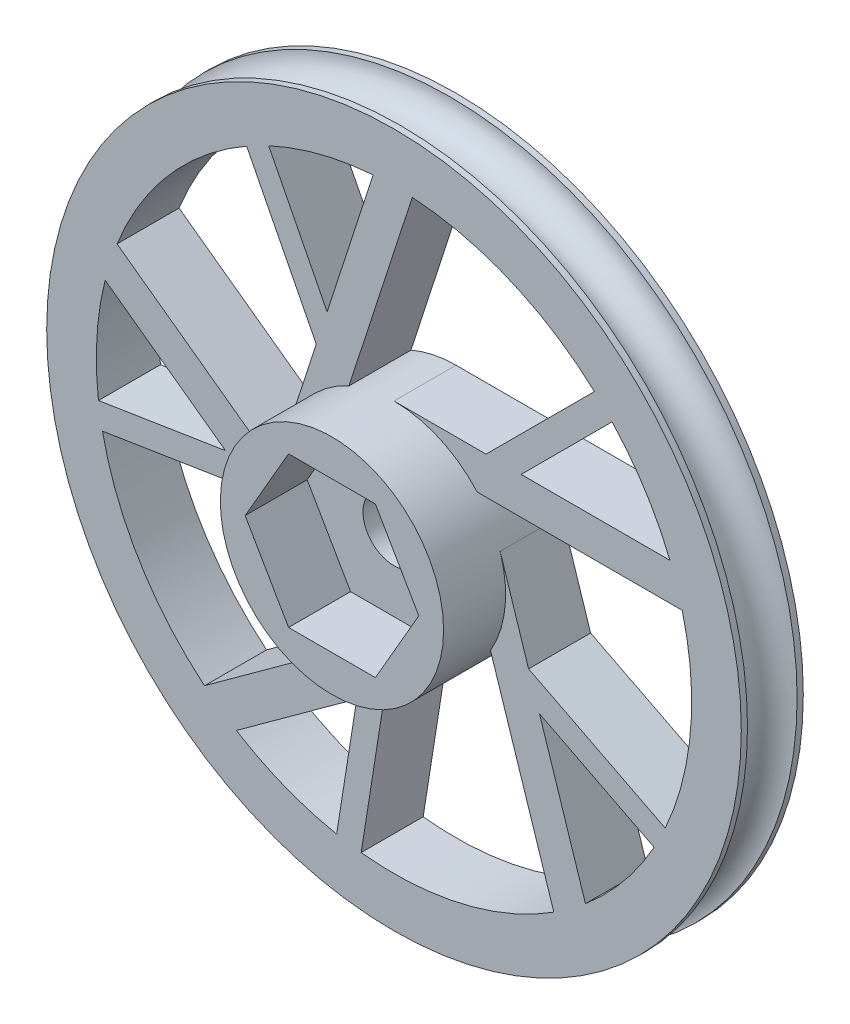
from build123d import *

# Parameters (mm, degrees)
SKETCH_1_R          = 28
SKETCH_1_R_2        = 24
EXTRUDE_1_DEPTH     = 5
SKETCH_1_3_R        = 9
EXTRUDE_2_DEPTH     = 10
SKETCH_2_R          = 2.5
CUT_EXTRUDE_1_DEPTH = 41.841155713
SKETCH_3_R          = 2


with BuildPart() as part:
    # 草图1 → 凸台-拉伸1 (new body)
    # profile 1 of 12: a face of its own
    with BuildSketch(Plane.XY):
        Circle(SKETCH_1_R)
        Circle(SKETCH_1_R_2, mode=Mode.SUBTRACT)
    # profile 2 of 12: a face of its own
    with BuildSketch(Plane.XY):
        with BuildLine():
            Line((-11.87931448, 20.853821892), (-6.26655053, 9.838152398))
            Line((-6.26655053, 9.838152398), (-5.392518481, 12.528146446))
            Line((-5.392518481, 12.528146446), (-10.101735892, 21.770506011))
            ThreePointArc((-10.101735892, 21.770506011), (-11.000078241, 21.33068866), (-11.87931448, 20.853821892))
        make_face()
    # profile 3 of 12: a face of its own
    with BuildSketch(Plane.XY):
        with BuildLine():
            ThreePointArc((-8.559508647, 2.781152949), (-6.678325674, 6.033238449), (-3.633390081, 8.233983029))
            Line((-3.633390081, 8.233983029), (1.47456694, 23.95465826))
            ThreePointArc((1.47456694, 23.95465826), (-0.105101651, 23.999769866), (-1.684314548, 23.940824641))
            Line((-1.684314548, 23.940824641), (-5.392518481, 12.528146446))
            Line((-5.392518481, 12.528146446), (-6.26655053, 9.838152398))
            Line((-6.26655053, 9.838152398), (-8.559508647, 2.781152949))
        make_face()
    # profile 4 of 12: a face of its own
    with BuildSketch(Plane.XY):
        with BuildLine():
            Line((16.162253144, 17.742084807), (7.420168337, 9))
            Line((7.420168337, 9), (10.248595461, 9))
            Line((10.248595461, 9), (17.583373541, 16.33477808))
            ThreePointArc((17.583373541, 16.33477808), (16.887479331, 17.053241388), (16.162253144, 17.742084807))
        make_face()
    # profile 5 of 12: a face of its own
    with BuildSketch(Plane.XY):
        with BuildLine():
            Line((7.420168337, 9), (0, 9))
            ThreePointArc((0, 9), (3.674234614, 8.215838363), (6.708203932, 6))
            Line((6.708203932, 6), (23.237900077, 6))
            ThreePointArc((23.237900077, 6), (22.792659325, 7.51629436), (22.248595461, 9))
            Line((22.248595461, 9), (10.248595461, 9))
            Line((10.248595461, 9), (7.420168337, 9))
        make_face()
    # profile 6 of 12: a face of its own
    with BuildSketch(Plane.XY):
        with BuildLine():
            Line((10.852466764, -4.275846499), (8.559508647, 2.781152949))
            ThreePointArc((8.559508647, 2.781152949), (8.889195065, 1.407910185), (9, 0))
            ThreePointArc((9, 0), (8.689464685, -2.34375841), (7.779288115, -4.525779096))
            Line((7.779288115, -4.525779096), (12.887245135, -20.246454327))
            ThreePointArc((12.887245135, -20.246454327), (14.191739808, -19.354444483), (15.434702745, -18.378518742))
            Line((15.434702745, -18.378518742), (11.726498813, -6.965840547))
            Line((11.726498813, -6.965840547), (10.852466764, -4.275846499))
        make_face()
    # profile 7 of 12: a face of its own
    with BuildSketch(Plane.XY):
        with BuildLine():
            Line((21.868136258, -9.888610449), (10.852466764, -4.275846499))
            Line((10.852466764, -4.275846499), (11.726498813, -6.965840547))
            Line((11.726498813, -6.965840547), (20.968858378, -11.675057959))
            ThreePointArc((20.968858378, -11.675057959), (21.437114452, -10.791205863), (21.868136258, -9.888610449))
        make_face()
    # profile 8 of 12: a face of its own
    with BuildSketch(Plane.XY):
        with BuildLine():
            Line((-0.712975015, -11.642618467), (5.290067271, -7.281152949))
            ThreePointArc((5.290067271, -7.281152949), (1.856630381, -8.806413778), (-1.900339469, -8.797085307))
            Line((-1.900339469, -8.797085307), (-15.273144562, -18.512996926))
            ThreePointArc((-15.273144562, -18.512996926), (-14.021681764, -19.477998884), (-12.709424559, -20.358549246))
            Line((-12.709424559, -20.358549246), (-3.001220626, -13.305126218))
            Line((-3.001220626, -13.305126218), (-0.712975015, -11.642618467))
        make_face()
    # profile 9 of 12: a face of its own
    with BuildSketch(Plane.XY):
        with BuildLine():
            ThreePointArc((-4.623906358, -23.550360719), (-3.638613979, -23.722573391), (-2.647001666, -23.853582167))
            Line((-2.647001666, -23.853582167), (-0.712975015, -11.642618467))
            Line((-0.712975015, -11.642618467), (-3.001220626, -13.305126218))
            Line((-3.001220626, -13.305126218), (-4.623906358, -23.550360719))
        make_face()
    # profile 10 of 12: a face of its own
    with BuildSketch(Plane.XY):
        with BuildLine():
            Line((-23.504073256, -4.853714083), (-11.293109556, -2.919687432))
            Line((-11.293109556, -2.919687432), (-13.581355167, -1.257179681))
            Line((-13.581355167, -1.257179681), (-23.826589668, -2.879865413))
            ThreePointArc((-23.826589668, -2.879865413), (-23.685901563, -3.870150793), (-23.504073256, -4.853714083))
        make_face()
    # profile 11 of 12: a face of its own
    with BuildSketch(Plane.XY):
        with BuildLine():
            ThreePointArc((-5.290067271, -7.281152949), (-7.801666869, -4.487091939), (-8.953762497, -0.911118625))
            Line((-8.953762497, -0.911118625), (-22.32656759, 8.804792993))
            ThreePointArc((-22.32656759, 8.804792993), (-22.857615717, 7.31637914), (-23.2895591, 5.796243347))
            Line((-23.2895591, 5.796243347), (-13.581355167, -1.257179681))
            Line((-13.581355167, -1.257179681), (-11.293109556, -2.919687432))
            Line((-11.293109556, -2.919687432), (-5.290067271, -7.281152949))
        make_face()
    # profile 12 of 12: a face of its own
    with BuildSketch(Plane.XY):
        Polygon((7, 0), (3.5, 6.062177826), (-3.5, 6.062177826), (-7, 0), (-3.5, -6.062177826), (3.5, -6.062177826), align=None)
    extrude(amount=EXTRUDE_1_DEPTH)

    # 草图1<3> → 凸台-拉伸2 (add)
    with BuildSketch(Plane.XY):
        with Locations(Location((0, 0, 0), (0, 0, 185.810314896))):
            Circle(SKETCH_1_3_R)
        Polygon((3.5, 6.062177826), (-3.5, 6.062177826), (-7, 0), (-3.5, -6.062177826), (3.5, -6.062177826), (7, 0), align=None, mode=Mode.SUBTRACT)
    extrude(amount=EXTRUDE_2_DEPTH)

    # 草图2 → 切除-拉伸1 (cut, through all)
    with BuildSketch(Plane(origin=(0, 0, 0), x_dir=(-1, 0, 0), z_dir=(0, 0, -1))):
        Circle(SKETCH_2_R)
    extrude(amount=-CUT_EXTRUDE_1_DEPTH, mode=Mode.SUBTRACT)

    # 草图3 → 切除-旋转1 (revolve, cut)
    with BuildSketch(Plane(origin=(0, 0, 0), x_dir=(1, 0, 0), z_dir=(0, 1, 0))):
        with Locations((-28, -2.5)):
            Circle(SKETCH_3_R)
    revolve(axis=Axis((0, 0, 0), (0, 0, 1)), mode=Mode.SUBTRACT)


solid = part.part
